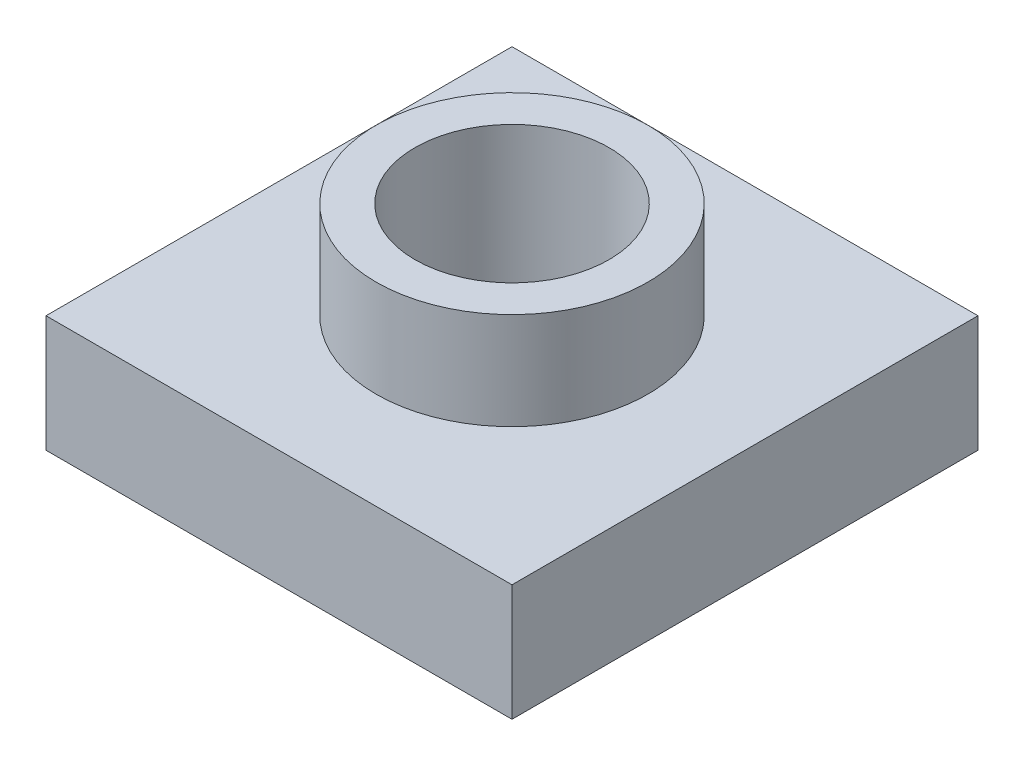
from build123d import *

# Parameters (mm, degrees)
ESQUISSE1_W             = 120
ESQUISSE1_H             = 120
BOSS_EXTRU_1_DEPTH      = 30
ESQUISSE3_R             = 35
BOSS_EXTRU_2_DEPTH      = 25
ESQUISSE6_R             = 25
ENL_V_MAT_EXTRU_2_DEPTH = 150.442672511


with BuildPart() as part:
    # Esquisse1 → Boss.-Extru.1 (new body)
    with BuildSketch(Plane(origin=(-22.840388269, 0, 13.944020093), x_dir=(1, 0, 0), z_dir=(0, 1, 0))):
        with Locations((60, 53.282442748)):
            Rectangle(ESQUISSE1_W, ESQUISSE1_H)
    extrude(amount=BOSS_EXTRU_1_DEPTH)

    # Esquisse3 → Boss.-Extru.2 (add)
    with BuildSketch(Plane(origin=(0, 30, 0), x_dir=(1, 0, 0), z_dir=(0, 1, 0))):
        with Locations(Location((37.159611731, 39.338422655, 0), (0, 0, 270))):
            Circle(ESQUISSE3_R)
    extrude(amount=BOSS_EXTRU_2_DEPTH)

    # Esquisse6 → Enlèv. mat.-Extru.2 (cut, through all)
    with BuildSketch(Plane(origin=(0, 55, 0), x_dir=(1, 0, 0), z_dir=(0, 1, 0))):
        with Locations(Location((37.159611731, 39.338422655, 0), (0, 0, 270))):
            Circle(ESQUISSE6_R)
    extrude(amount=-ENL_V_MAT_EXTRU_2_DEPTH, mode=Mode.SUBTRACT)


solid = part.part
